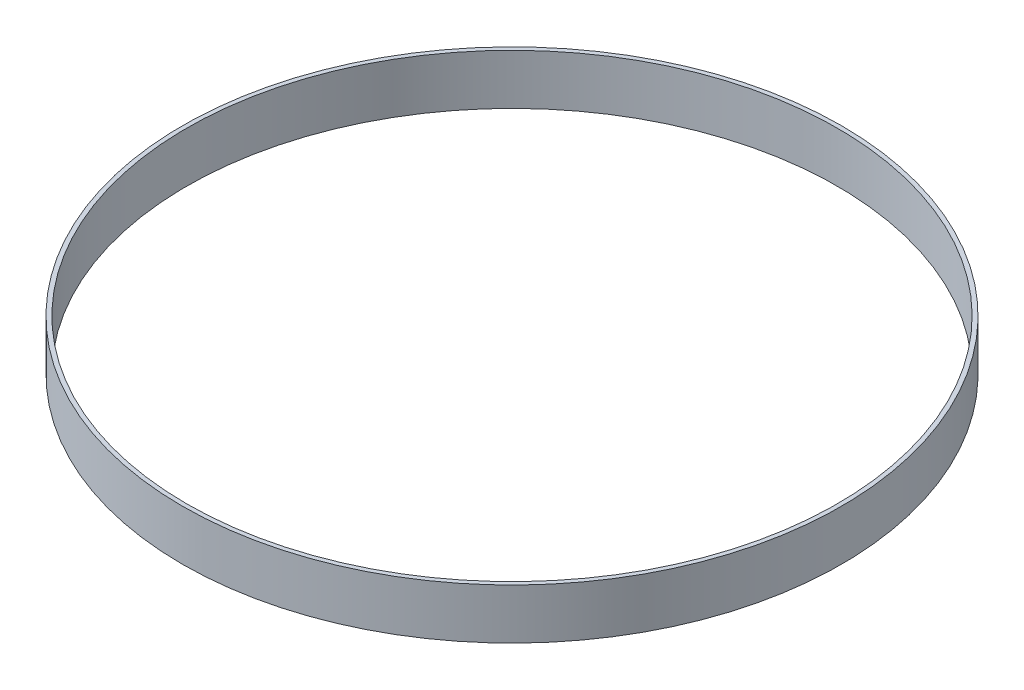
from build123d import *

# Parameters (mm, degrees)
SKETCH1_R           = 39.3
SKETCH1_R_2         = 38.8
BOSS_EXTRUDE1_DEPTH = 6


with BuildPart() as part:
    # Sketch1 → Boss-Extrude1 (new body)
    with BuildSketch(Plane(origin=(0, 0, 0), x_dir=(1, 0, 0), z_dir=(0, 1, 0))):
        with Locations(Location((0, 0, 0), (0, 0, 270))):
            Circle(SKETCH1_R)
        with Locations(Location((0, 0, 0), (0, 0, 270))):
            Circle(SKETCH1_R_2, mode=Mode.SUBTRACT)
    extrude(amount=BOSS_EXTRUDE1_DEPTH)


solid = part.part
